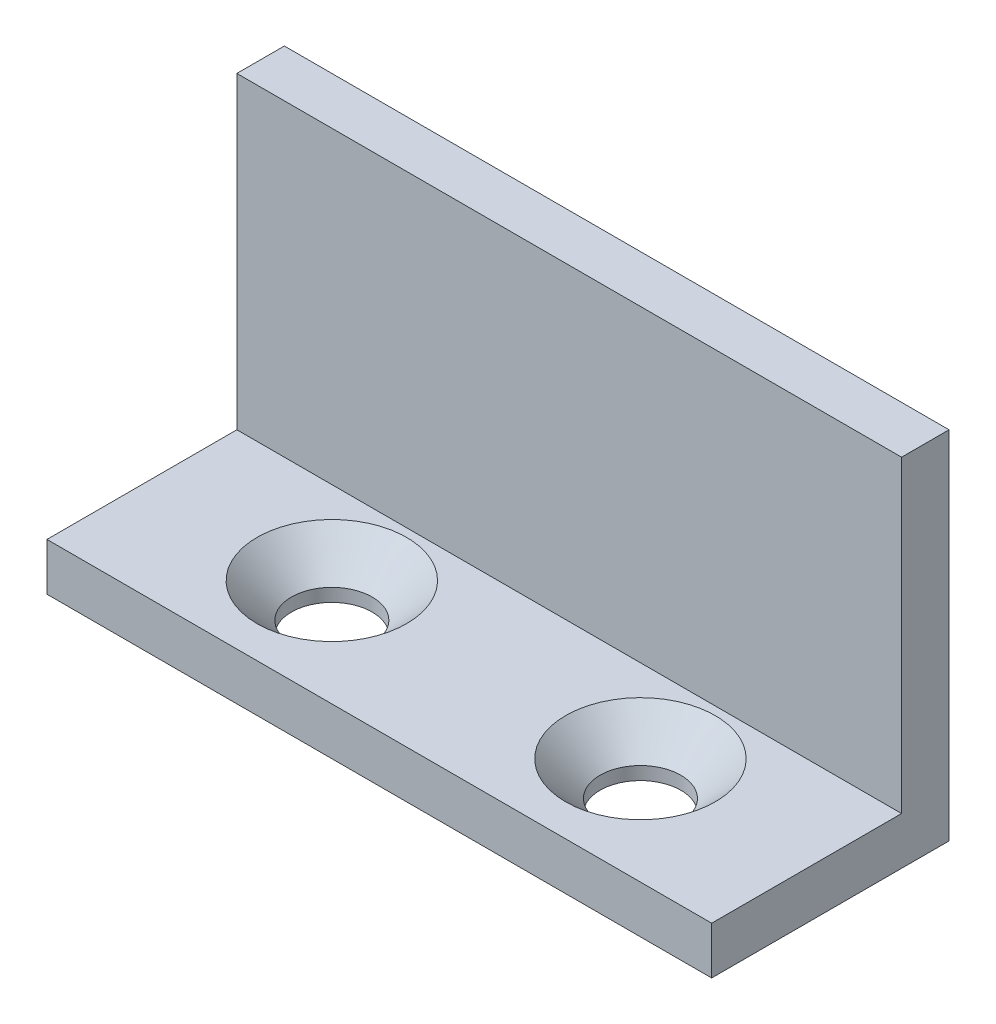
from build123d import *

# Parameters (mm, degrees)
BOSS_EXTRUDE1_DEPTH                          = 28
CSK_FOR_M3_COUNTERSUNK_FLAT_HEAD_SCR_2_COUNT = 2
CSK_FOR_M3_COUNTERSUNK_FLAT_HEAD_SCR_2_PITCH = 13


with BuildPart() as part:
    # Sketch1 → Boss-Extrude1 (new body)
    with BuildSketch(Plane(origin=(0, 0, 0), x_dir=(0, 0, -1), z_dir=(1, 0, 0))):
        Polygon((-10, 0), (0, 0), (0, 15), (-2, 15), (-2, 2), (-10, 2), align=None)
    extrude(amount=BOSS_EXTRUDE1_DEPTH)

    # Sketch3 → CSK for M3 Countersunk Flat Head Screw1 (revolve, cut)
    with BuildSketch(Plane(origin=(7.5, 2, 5.5), x_dir=(0, 0, 1), z_dir=(1, 0, 0))):
        Polygon((0, 0), (0, 2), (1.7, 2), (1.7, 1.45), (3.15, 0), align=None)
    csk_for_m3_countersunk_flat_head_screw1 = revolve(axis=Axis((7.5, 8.35, 5.5), (0, -1, 0)), mode=Mode.SUBTRACT)

    # CSK for M3 Countersunk Flat Head Scr 2: CSK for M3 Countersunk Flat Head Screw1 ×2
    with Locations(*[(i * CSK_FOR_M3_COUNTERSUNK_FLAT_HEAD_SCR_2_PITCH, 0, 0) for i in range(1, CSK_FOR_M3_COUNTERSUNK_FLAT_HEAD_SCR_2_COUNT)]):
        add(csk_for_m3_countersunk_flat_head_screw1, mode=Mode.SUBTRACT)


solid = part.part
